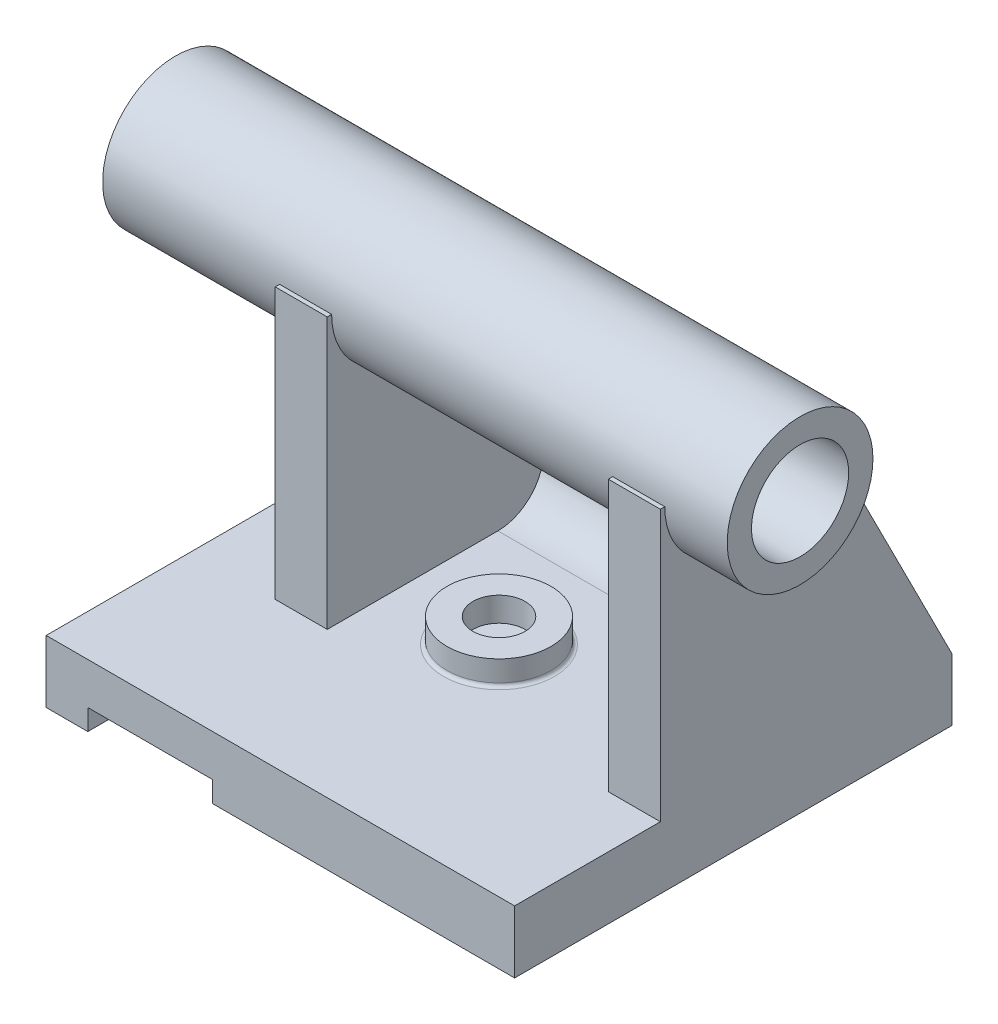
from build123d import *

# Parameters (mm, degrees)
BOSS_EXTRUDE1_DEPTH  = 126
BOSS_EXTRUDE2_DEPTH  = 15
SKETCH6_W            = 15
SKETCH6_H            = 84
BOSS_EXTRUDE3_DEPTH  = 78
CUT_EXTRUDE1_DEPTH   = 78
SKETCH14_R           = 15
SKETCH14_R_2         = 7.5
BOSS_EXTRUDE9_DEPTH  = 7
BOSS_EXTRUDE10_DEPTH = 12
BOSS_EXTRUDE11_DEPTH = 81
SKETCH12_R           = 21
BOSS_EXTRUDE12_DEPTH = 180
SKETCH20_R           = 14
CUT_EXTRUDE3_DEPTH   = 180
FILLET2_R            = 1
SKETCH22_W           = 36
SKETCH22_H           = 6
CUT_EXTRUDE4_DEPTH   = 180


with BuildPart() as part:
    # Sketch2 → Boss-Extrude1 (new body)
    with BuildSketch(Plane.XY):
        Polygon((19.5, -9), (67.5, -9), (67.5, 9), (-67.5, 9), (-67.5, -9), align=None)
    extrude(amount=-BOSS_EXTRUDE1_DEPTH)

    # Sketch4 → Boss-Extrude2 (add)
    with BuildSketch(Plane(origin=(67.5, 0, 0), x_dir=(0, 0, -1), z_dir=(1, 0, 0))):
        Polygon((42, 87), (42, 9), (126, 9), (86.534971332, 87), align=None)
    extrude(amount=-BOSS_EXTRUDE2_DEPTH)

    # Sketch6 → Boss-Extrude3 (add)
    with BuildSketch(Plane(origin=(0, 9, 0), x_dir=(1, 0, 0), z_dir=(0, 1, 0))):
        with Locations((-36, 84)):
            Rectangle(SKETCH6_W, SKETCH6_H)
    extrude(amount=BOSS_EXTRUDE3_DEPTH)

    # Sketch7 → Cut-Extrude1 (cut)
    with BuildSketch(Plane.ZY.offset(43.5)):
        Polygon((-126, 9), (-126, 87), (-86.355196091, 87), align=None)
    extrude(amount=-CUT_EXTRUDE1_DEPTH, mode=Mode.SUBTRACT)

    # Sketch14 → Boss-Extrude9 (add)
    with BuildSketch(Plane(origin=(0, 9, 0), x_dir=(1, 0, 0), z_dir=(0, 1, 0))):
        with Locations(Location((0, 63, 0), (0, 0, 270))):
            Circle(SKETCH14_R)
        with Locations(Location((0, 63, 0), (0, 0, 270))):
            Circle(SKETCH14_R_2, mode=Mode.SUBTRACT)
    extrude(amount=BOSS_EXTRUDE9_DEPTH)

    # Sketch17 → Boss-Extrude10 (add)
    with BuildSketch(Plane(origin=(0, 52.741614031, -103.767593449), x_dir=(-1, 0, 0), z_dir=(0, 0.45309943810587516, -0.8914599818209118))):
        Polygon((-52.5, 38.348071531), (28.5, 38.429527592), (28.5, -49.067389365), (-52.5, -49.067389365), align=None)
    extrude(amount=-BOSS_EXTRUDE10_DEPTH)

    # Sketch19 → Boss-Extrude11 (add)
    with BuildSketch(Plane(origin=(-28.5, 0, 0), x_dir=(0, 0, -1), z_dir=(1, 0, 0))):
        with BuildLine():
            Line((112.551444953, 9), (91.179997144, 9))
            ThreePointArc((91.179997144, 9), (102.372349762, 15.257609096), (102.902998621, 28.069511395))
            Line((102.902998621, 28.069511395), (112.551444953, 9))
        make_face()
    extrude(amount=BOSS_EXTRUDE11_DEPTH)

    # Sketch12 → Boss-Extrude12 (add)
    with BuildSketch(Plane(origin=(85.5, 0, 0), x_dir=(0, 0, -1), z_dir=(1, 0, 0))):
        with Locations((64.267485666, 87)):
            Circle(SKETCH12_R)
    extrude(amount=-BOSS_EXTRUDE12_DEPTH)

    # Sketch20 → Cut-Extrude3 (cut)
    with BuildSketch(Plane(origin=(85.5, 0, 0), x_dir=(0, 0, -1), z_dir=(1, 0, 0))):
        with Locations((64.267485666, 87)):
            Circle(SKETCH20_R)
    extrude(amount=-CUT_EXTRUDE3_DEPTH, mode=Mode.SUBTRACT)

    # Fillet2
    fillet2_edges = [part.edges().sort_by_distance(p)[0] for p in [
        (0, 9, -78),
    ]]
    fillet(fillet2_edges, radius=FILLET2_R)

    # Sketch22 → Cut-Extrude4 (cut)
    with BuildSketch(Plane.XY):
        with Locations((-37.5, -6)):
            Rectangle(SKETCH22_W, SKETCH22_H)
    extrude(amount=-CUT_EXTRUDE4_DEPTH, mode=Mode.SUBTRACT)


solid = part.part
